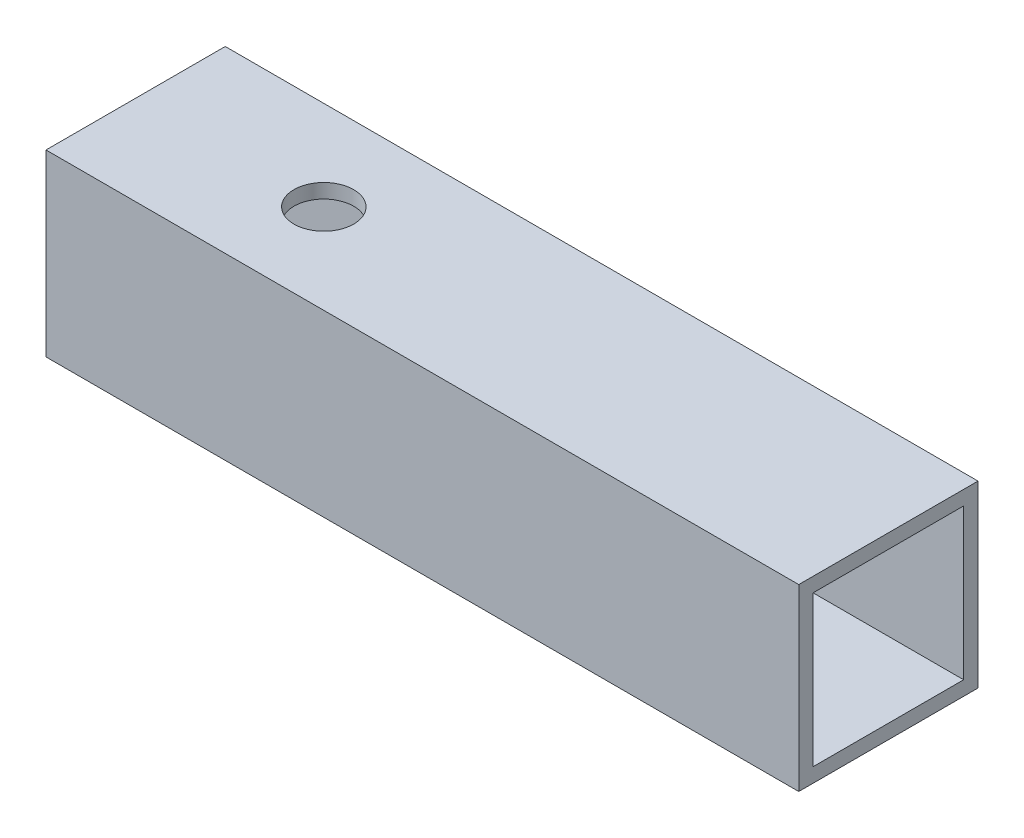
from build123d import *

# Parameters (mm, degrees)
SKETCH1_W           = 4.7625
SKETCH1_H           = 4.7625
BOSS_EXTRUDE1_DEPTH = 20
SKETCH2_W           = 4
SKETCH2_H           = 4
CUT_EXTRUDE1_DEPTH  = 21.281536015
SKETCH3_R           = 0.79375
CUT_EXTRUDE2_DEPTH  = 10


with BuildPart() as part:
    # Sketch1 → Boss-Extrude1 (new body)
    with BuildSketch(Plane(origin=(0, 0, 0), x_dir=(0, 0, -1), z_dir=(1, 0, 0))):
        Rectangle(SKETCH1_W, SKETCH1_H)
    extrude(amount=BOSS_EXTRUDE1_DEPTH)

    # Sketch2 → Cut-Extrude1 (cut, through all)
    with BuildSketch(Plane.ZY):
        Rectangle(SKETCH2_W, SKETCH2_H)
    extrude(amount=-CUT_EXTRUDE1_DEPTH, mode=Mode.SUBTRACT)

    # Sketch3 → Cut-Extrude2 (cut)
    with BuildSketch(Plane(origin=(0, 2.38125, 0), x_dir=(1, 0, 0), z_dir=(0, 1, 0))):
        with Locations(Location((5, 0, 0), (0, 0, 270))):
            Circle(SKETCH3_R)
    extrude(amount=-CUT_EXTRUDE2_DEPTH, mode=Mode.SUBTRACT)


solid = part.part
